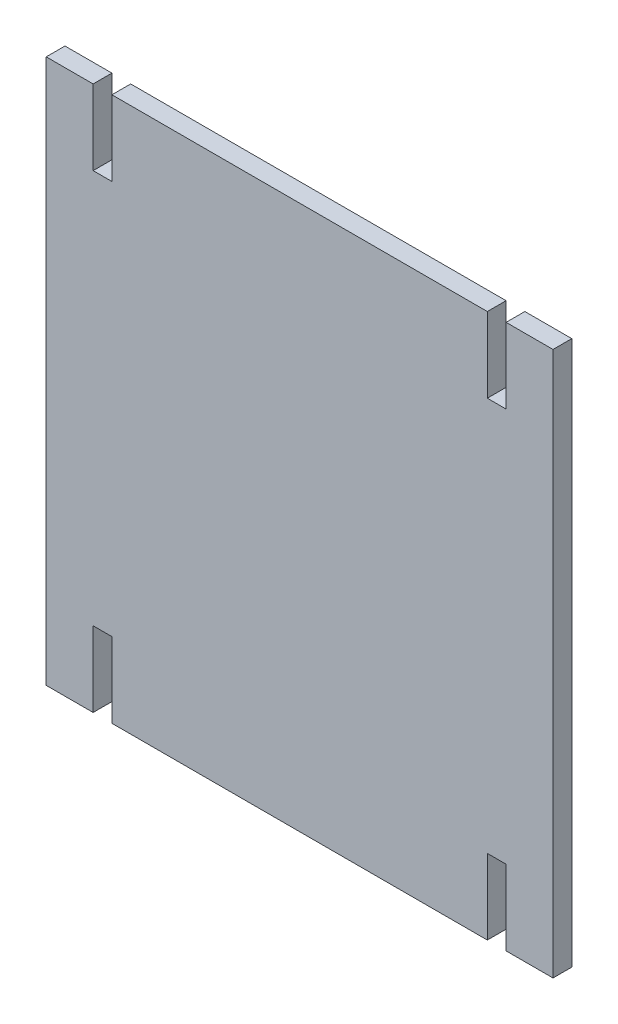
from build123d import *

# Parameters (mm, degrees)
BOSS_EXTRUDE1_DEPTH = 2.54


with BuildPart() as part:
    # Sketch1 → Boss-Extrude1 (new body)
    with BuildSketch(Plane.XY):
        Polygon((0, 0), (0, -10.16), (-2.54, -10.16), (-2.54, 0), (-8.89, 0), (-8.89, -73.66), (-2.54, -73.66), (-2.54, -63.5), (0, -63.5), (0, -73.66), (50.8, -73.66), (50.8, -63.5), (53.34, -63.5), (53.34, -73.66), (59.69, -73.66), (59.69, 0), (53.34, 0), (53.34, -10.16), (50.8, -10.16), (50.8, 0), align=None)
    extrude(amount=BOSS_EXTRUDE1_DEPTH)


solid = part.part
